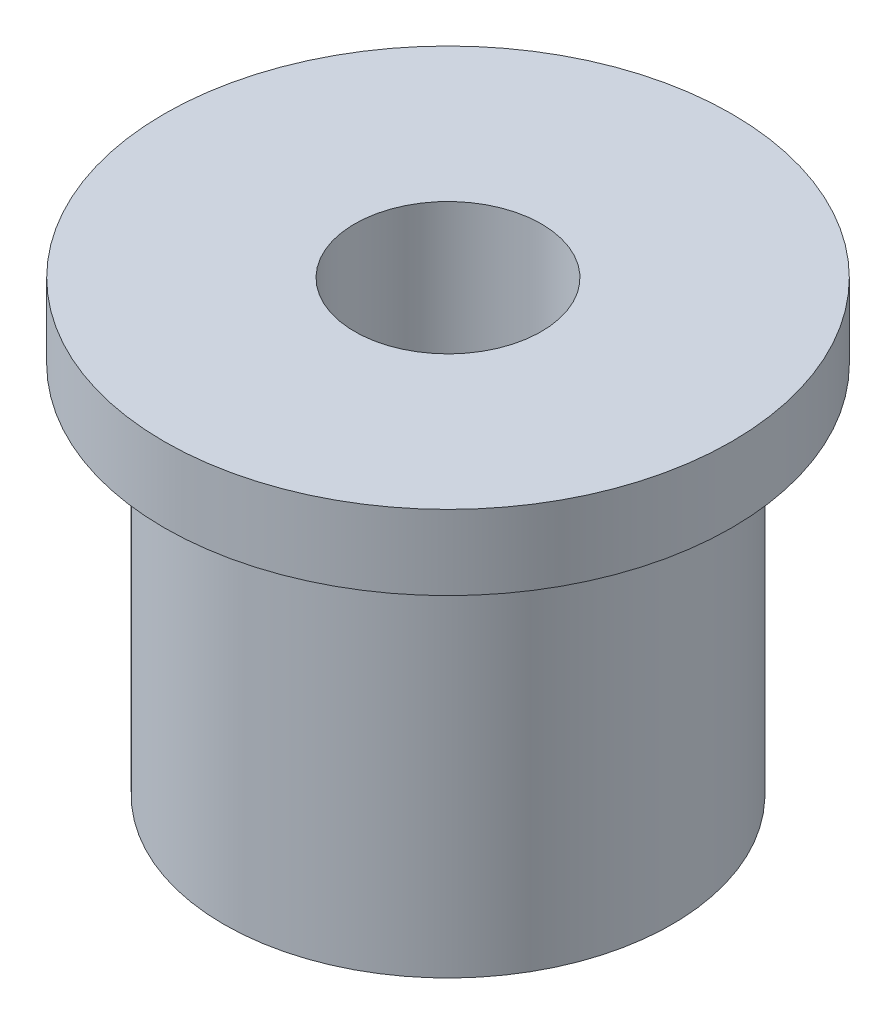
from build123d import *


with BuildPart() as part:
    # Sketch1 → Revolve1 (revolve)
    with BuildSketch(Plane(origin=(0, 0, 0), x_dir=(0, 0, -1), z_dir=(1, 0, 0))):
        Polygon((1.25, 0), (1.25, 6), (3.8, 6), (3.8, 5), (3, 5), (3, 0), align=None)
    revolve(axis=Axis((0, 0, 0), (0, 1, 0)))


solid = part.part
